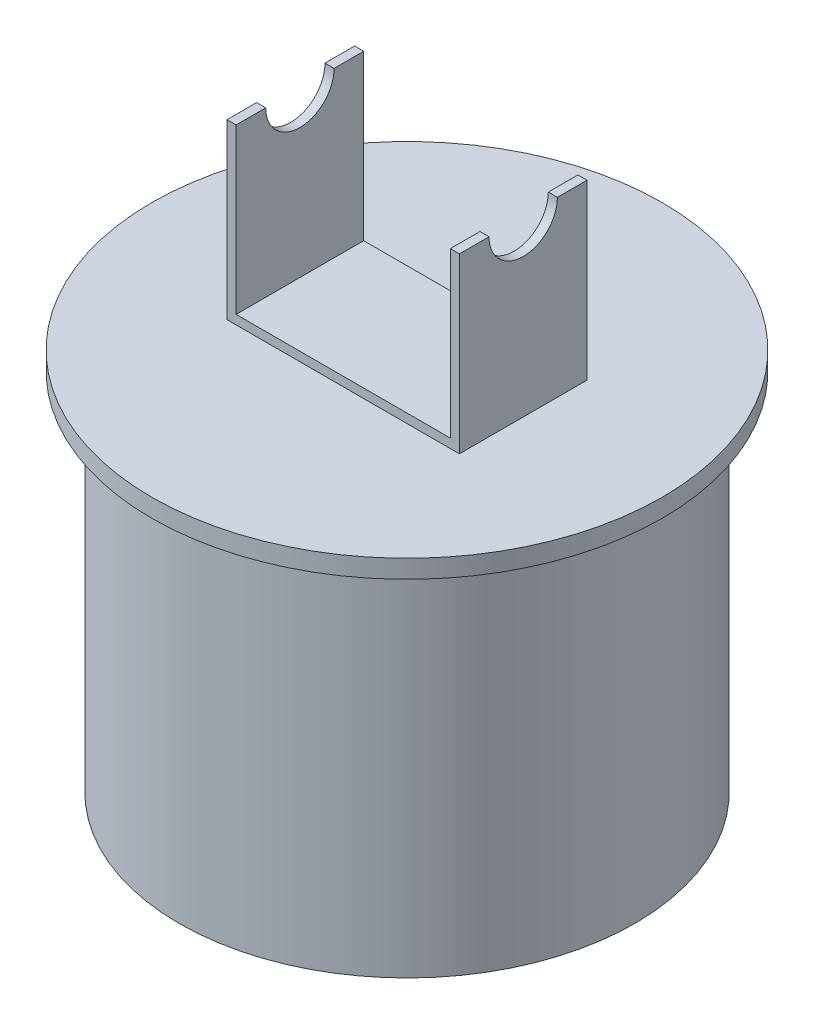
from build123d import *

# Parameters (mm, degrees)
SKETCH1_R           = 50
BOSS_EXTRUDE1_DEPTH = 80
SKETCH1_3_R         = 56
BOSS_EXTRUDE2_DEPTH = 4
SKETCH5_W           = 51
SKETCH5_H           = 28
BOSS_EXTRUDE4_DEPTH = 38
SKETCH6_W           = 47
SKETCH6_H           = 28
CUT_EXTRUDE2_DEPTH  = 36
SKETCH8_R           = 7.5
CUT_EXTRUDE3_DEPTH  = 51


with BuildPart() as part:
    # Sketch1 → Boss-Extrude1 (new body)
    with BuildSketch(Plane(origin=(0, 0, 0), x_dir=(1, 0, 0), z_dir=(0, 1, 0))):
        Circle(SKETCH1_R)
    extrude(amount=-BOSS_EXTRUDE1_DEPTH)

    # Sketch1<3> → Boss-Extrude2 (add)
    with BuildSketch(Plane(origin=(0, 0, 0), x_dir=(1, 0, 0), z_dir=(0, 1, 0))):
        Circle(SKETCH1_3_R)
    extrude(amount=BOSS_EXTRUDE2_DEPTH)

    # Sketch5 → Boss-Extrude4 (add)
    with BuildSketch(Plane(origin=(0, 4, 0), x_dir=(1, 0, 0), z_dir=(0, 1, 0))):
        Rectangle(SKETCH5_W, SKETCH5_H)
    extrude(amount=BOSS_EXTRUDE4_DEPTH)

    # Sketch6 → Cut-Extrude2 (cut)
    with BuildSketch(Plane(origin=(0, 42, 0), x_dir=(1, 0, 0), z_dir=(0, 1, 0))):
        Rectangle(SKETCH6_W, SKETCH6_H)
    extrude(amount=-CUT_EXTRUDE2_DEPTH, mode=Mode.SUBTRACT)

    # Sketch8 → Cut-Extrude3 (cut)
    with BuildSketch(Plane(origin=(25.5, 0, 0), x_dir=(0, 0, -1), z_dir=(1, 0, 0))):
        with Locations((0, 42)):
            Circle(SKETCH8_R)
    extrude(amount=-CUT_EXTRUDE3_DEPTH, mode=Mode.SUBTRACT)


solid = part.part
